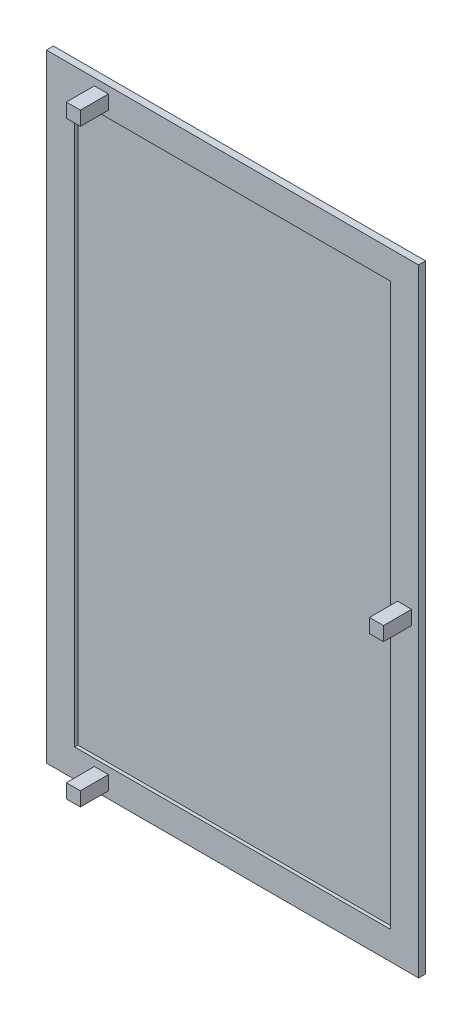
from build123d import *

# Parameters (mm, degrees)
SKETCH1_W           = 66.3
SKETCH1_H           = 110
BOSS_EXTRUDE1_DEPTH = 1.25
SKETCH2_W           = 2.5
SKETCH2_H           = 2.5
BOSS_EXTRUDE2_DEPTH = 5
SKETCH3_W           = 56.3
SKETCH3_H           = 100
CUT_EXTRUDE1_DEPTH  = 0.6


with BuildPart() as part:
    # Sketch1 → Boss-Extrude1 (new body)
    with BuildSketch(Plane.XY):
        with Locations((33.15, 55)):
            Rectangle(SKETCH1_W, SKETCH1_H)
    extrude(amount=BOSS_EXTRUDE1_DEPTH)

    # Sketch2 → Boss-Extrude2 (add)
    with BuildSketch(Plane.XY.offset(1.25)):
        with Locations((9.8, 2.5)):
            Rectangle(SKETCH2_W, SKETCH2_H)
        with Locations((9.8, 107.5)):
            Rectangle(SKETCH2_W, SKETCH2_H)
        with Locations((63.8, 55)):
            Rectangle(SKETCH2_W, SKETCH2_H)
    extrude(amount=BOSS_EXTRUDE2_DEPTH)

    # Sketch3 → Cut-Extrude1 (cut)
    with BuildSketch(Plane.XY.offset(1.25)):
        with Locations((33.15, 55)):
            Rectangle(SKETCH3_W, SKETCH3_H)
    extrude(amount=-CUT_EXTRUDE1_DEPTH, mode=Mode.SUBTRACT)


solid = part.part
